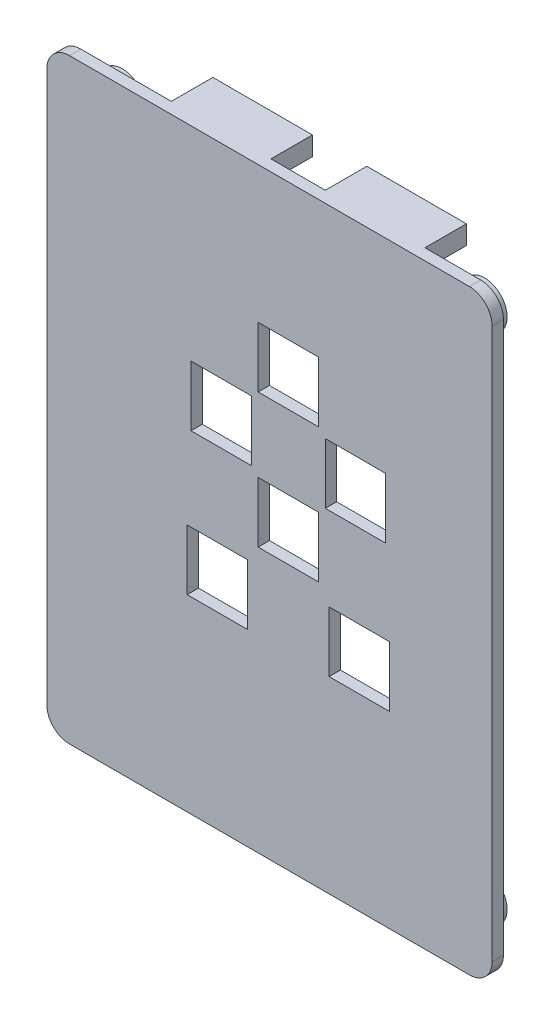
from build123d import *

# Parameters (mm, degrees)
EXTRUDE_1_DEPTH     = 1.5
SKETCH_1_10_W       = 2.5
SKETCH_1_10_H       = 14
EXTRUDE_2_DEPTH     = 8.5
SKETCH_1_11_W       = 13.2
SKETCH_1_11_H       = 2.5
SKETCH_1_11_W_2     = 13
EXTRUDE_3_DEPTH     = 5.5
SKETCH_1_13_R       = 3
EXTRUDE_4_DEPTH     = 3
SKETCH_1_14_W       = 8.6
SKETCH_1_14_H       = 2.5
EXTRUDE_5_DEPTH     = 1
SKETCH_1_15_R       = 2
CUT_EXTRUDE_1_DEPTH = 1.4


with BuildPart() as part:
    # 草图1 → 凸台-拉伸1 (new body)
    with BuildSketch(Plane.XY):
        with BuildLine():
            ThreePointArc((-26.5, 39.5), (-28.621320344, 38.621320344), (-29.5, 36.5))
            Line((-29.5, 36.5), (-29.5, -36.5))
            ThreePointArc((-29.5, -36.5), (-28.621320344, -38.621320344), (-26.5, -39.5))
            Line((-26.5, -39.5), (26.5, -39.5))
            ThreePointArc((26.5, -39.5), (28.621320344, -38.621320344), (29.5, -36.5))
            Line((29.5, -36.5), (29.5, 36.5))
            ThreePointArc((29.5, 36.5), (28.621320344, 38.621320344), (26.5, 39.5))
            Line((26.5, 39.5), (-26.5, 39.5))
        make_face()
        Polygon((-2.9, -6.56), (-2.9, -10.56), (-2.9, -14.56), (-10.9, -14.56), (-10.9, -6.56), align=None, mode=Mode.SUBTRACT)
        Polygon((7.9, -14.56), (7.9, -10.56), (7.9, -6.56), (15.9, -6.56), (15.9, -14.56), align=None, mode=Mode.SUBTRACT)
        Polygon((-1.5, 3.6), (2.5, 3.6), (6.5, 3.6), (6.5, -4.4), (2.5, -4.4), (-1.5, -4.4), align=None, mode=Mode.SUBTRACT)
        Polygon((-2.4, 12.5), (-2.4, 8.5), (-2.4, 4.5), (-10.4, 4.5), (-10.4, 12.5), align=None, mode=Mode.SUBTRACT)
        Polygon((7.4, 8.5), (7.4, 12.5), (15.4, 12.5), (15.4, 4.5), (7.4, 4.5), align=None, mode=Mode.SUBTRACT)
        Polygon((6.5, 13.4), (2.5, 13.4), (-1.5, 13.4), (-1.5, 21.4), (6.5, 21.4), align=None, mode=Mode.SUBTRACT)
    extrude(amount=EXTRUDE_1_DEPTH)

    # 草图1<10> → 凸台-拉伸2 (add)
    with BuildSketch(Plane.XY):
        with Locations((-28.25, 14)):
            Rectangle(SKETCH_1_10_W, SKETCH_1_10_H)
        with Locations((-28.25, -5)):
            Rectangle(SKETCH_1_10_W, SKETCH_1_10_H)
    extrude(amount=-EXTRUDE_2_DEPTH)

    # 草图1<11> → 凸台-拉伸3 (add)
    with BuildSketch(Plane.XY):
        with Locations((-7.9, 38.25)):
            Rectangle(SKETCH_1_11_W, SKETCH_1_11_H)
        with Locations((12.5, 38.25)):
            Rectangle(SKETCH_1_11_W, SKETCH_1_11_H)
        with Locations((-15.2, -38.25)):
            Rectangle(SKETCH_1_11_W_2, SKETCH_1_11_H)
    extrude(amount=-EXTRUDE_3_DEPTH)

    # 草图1<13> → 凸台-拉伸4 (add)
    with BuildSketch(Plane.XY):
        with Locations((24, 34)):
            Circle(SKETCH_1_13_R)
        with Locations((-24, 34)):
            Circle(SKETCH_1_13_R)
        with Locations((-24, -34)):
            Circle(SKETCH_1_13_R)
        with Locations((24, -34)):
            Circle(SKETCH_1_13_R)
    extrude(amount=-EXTRUDE_4_DEPTH)

    # 草图1<14> → 凸台-拉伸5 (add)
    with BuildSketch(Plane.XY):
        with Locations((-4.4, -38.25)):
            Rectangle(SKETCH_1_14_W, SKETCH_1_14_H)
    extrude(amount=-EXTRUDE_5_DEPTH)

    # 草图1<15> → 切除-拉伸1 (cut)
    with BuildSketch(Plane.XY):
        with Locations((2.5, 9.8)):
            Circle(SKETCH_1_15_R)
        with Locations((-8.93, -4.21)):
            Circle(SKETCH_1_15_R)
        with Locations((13.93, -4.21)):
            Circle(SKETCH_1_15_R)
        with Locations((2.5, -6.444870341)):
            Circle(SKETCH_1_15_R)
    extrude(amount=CUT_EXTRUDE_1_DEPTH, mode=Mode.SUBTRACT)


solid = part.part
